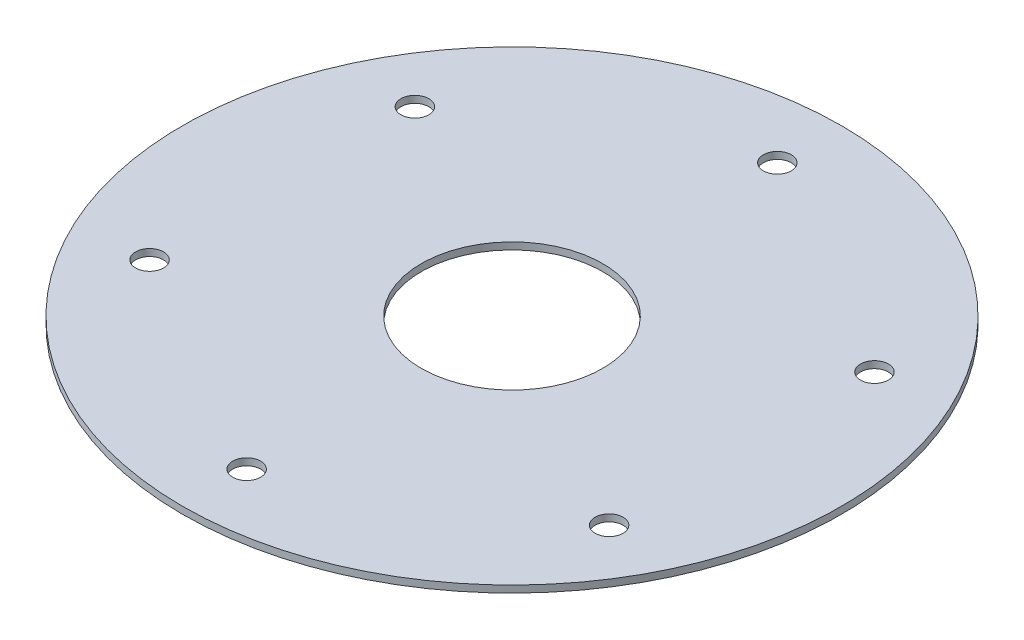
from build123d import *

# Parameters (mm, degrees)
SKETCH1_R           = 47.2
BOSS_EXTRUDE1_DEPTH = 1
SKETCH2_R           = 13
CUT_EXTRUDE1_DEPTH  = 1
SKETCH4_R           = 2
CUT_EXTRUDE3_DEPTH  = 67.758370262
CIRPATTERN1_COUNT   = 6


with BuildPart() as part:
    # Sketch1 → Boss-Extrude1 (new body)
    with BuildSketch(Plane(origin=(0, 0, 0), x_dir=(1, 0, 0), z_dir=(0, 1, 0))):
        with Locations(Location((0, 0, 0), (0, 0, 270))):
            Circle(SKETCH1_R)
    extrude(amount=BOSS_EXTRUDE1_DEPTH)

    # Sketch2 → Cut-Extrude1 (cut)
    with BuildSketch(Plane(origin=(0, 1, 0), x_dir=(1, 0, 0), z_dir=(0, 1, 0))):
        with Locations(Location((0, 0, 0), (0, 0, 270))):
            Circle(SKETCH2_R)
    extrude(amount=-CUT_EXTRUDE1_DEPTH, mode=Mode.SUBTRACT)

    # Sketch4 → Cut-Extrude3 (cut, through all)
    with BuildSketch(Plane(origin=(0, 1, 0), x_dir=(1, 0, 0), z_dir=(0, 1, 0))):
        with Locations(Location((0, 38, 0), (0, 0, 270))):
            Circle(SKETCH4_R)
    cut_extrude3 = extrude(amount=-CUT_EXTRUDE3_DEPTH, mode=Mode.SUBTRACT)

    # CirPattern1: Cut-Extrude3 ×6 about axis
    cirpattern1_axis = Axis((0, 0, 0), (0, 1, 0))
    for i in range(1, CIRPATTERN1_COUNT):
        add(cut_extrude3.rotate(cirpattern1_axis, i * 360 / CIRPATTERN1_COUNT), mode=Mode.SUBTRACT)


solid = part.part
